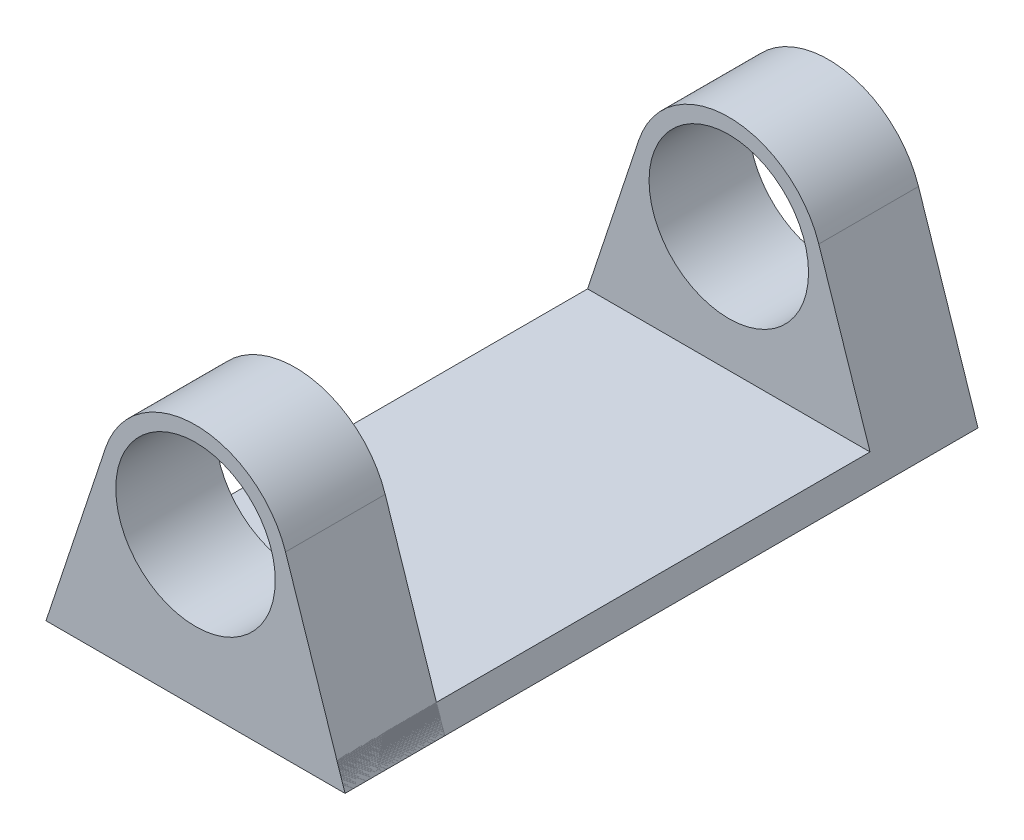
from build123d import *

# Parameters (mm, degrees)
BOSS_EXTRUDE2_DEPTH      = 0.0001
BOSS_EXTRUDE2_DEPTH_BACK = 1
SKETCH5_R                = 0.8
SKETCH7_R                = 0.8
BOSS_EXTRUDE3_DEPTH      = 1
BOSS_EXTRUDE4_DEPTH      = 5.35


with BuildPart() as part:
    # Sketch5 → Boss-Extrude2 (new, two sides: drawn at the far end of the back side and taken through both)
    with BuildSketch(Plane.XY.offset(-BOSS_EXTRUDE2_DEPTH_BACK)):
        with BuildLine():
            Line((-5.903029301, -6.032181157), (-6.5, -7.831743939))
            Line((-6.5, -7.831743939), (-3.5, -7.831743939))
            Line((-3.5, -7.831743939), (-4.096970699, -6.032181157))
            ThreePointArc((-4.096970699, -6.032181157), (-5, -5.380324064), (-5.903029301, -6.032181157))
        make_face()
        with Locations((-5, -6.331743939)):
            Circle(SKETCH5_R, mode=Mode.SUBTRACT)
    extrude(amount=BOSS_EXTRUDE2_DEPTH + BOSS_EXTRUDE2_DEPTH_BACK)

    # Sketch8 → Boss-Extrude4 (add)
    with BuildSketch(Plane.XY):
        Polygon((-6.417067259, -7.581743939), (-6.5, -7.831743939), (-3.5, -7.831743939), (-3.582932741, -7.581743939), align=None)
    extrude(amount=BOSS_EXTRUDE4_DEPTH)


with BuildPart() as body_2:
    # Sketch7 → Boss-Extrude3 (new body)
    with BuildSketch(Plane.XY.offset(5.3501)):
        with BuildLine():
            Line((-5.903029301, -6.032181157), (-6.5, -7.831743939))
            Line((-6.5, -7.831743939), (-3.5, -7.831743939))
            Line((-3.5, -7.831743939), (-4.096970699, -6.032181157))
            ThreePointArc((-4.096970699, -6.032181157), (-5, -5.380324064), (-5.903029301, -6.032181157))
        make_face()
        with Locations((-5, -6.331743939)):
            Circle(SKETCH7_R, mode=Mode.SUBTRACT)
    extrude(amount=-BOSS_EXTRUDE3_DEPTH)


solid = Compound([part.part, body_2.part])
